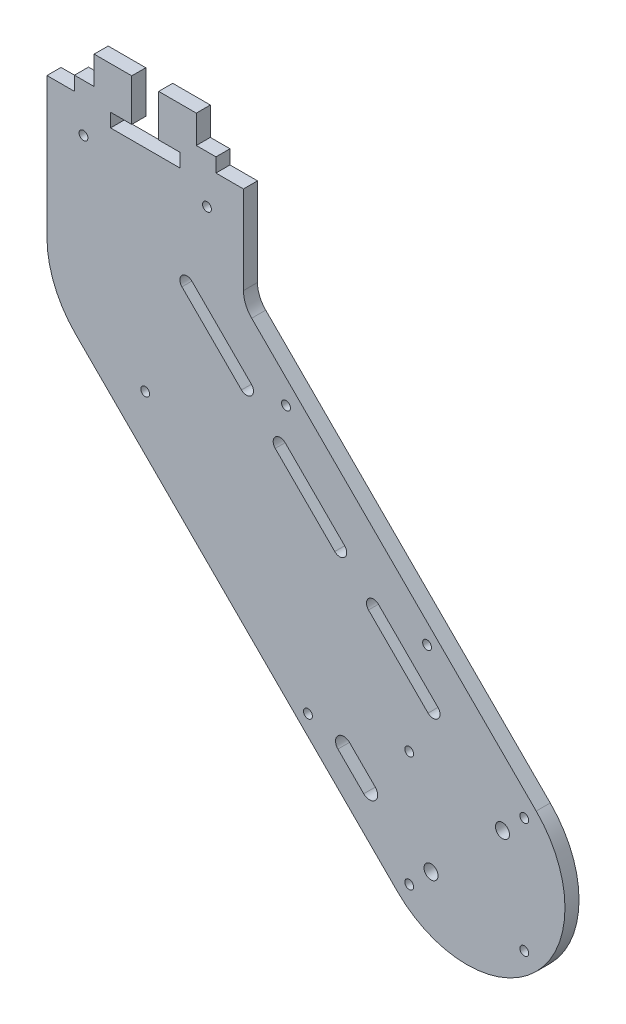
from build123d import *

# Parameters (mm, degrees)
SKETCH1_R           = 1.575
SKETCH1_R_2         = 2.5
BOSS_EXTRUDE1_DEPTH = 5
SKETCH3_W           = 13.4
SKETCH3_H           = 5
BOSS_EXTRUDE2_DEPTH = 5


with BuildPart() as part:
    # Sketch1 → Boss-Extrude1 (new body)
    with BuildSketch(Plane.XY):
        with BuildLine():
            Line((-139.300035894, 89.802561211), (-24.748737342, -24.748737342))
            ThreePointArc((-24.748737342, -24.748737342), (24.748737342, -24.748737342), (24.748737342, 24.748737342))
            Line((24.748737342, 24.748737342), (-54.672802234, 104.170276917))
            Line((-54.672802234, 104.170276917), (-76.622366364, 126.119841047))
            ThreePointArc((-76.622366364, 126.119841047), (-78.790093877, 129.364074535), (-79.551298552, 133.190908859))
            Line((-79.551298552, 133.190908859), (-79.551298552, 164.551298552))
            Line((-79.551298552, 164.551298552), (-89.351298552, 164.551298552))
            Line((-89.351298552, 164.551298552), (-89.351298552, 169.551298552))
            Line((-89.351298552, 169.551298552), (-96.351298552, 169.551298552))
            Line((-96.351298552, 169.551298552), (-96.351298552, 174.551298552))
            Line((-96.351298552, 174.551298552), (-109.751298552, 174.551298552))
            Line((-109.751298552, 174.551298552), (-109.751298552, 169.551298552))
            Line((-109.751298552, 169.551298552), (-109.751298552, 164.551298552))
            Line((-109.751298552, 164.551298552), (-102.201298552, 164.551298552))
            Line((-102.201298552, 164.551298552), (-102.201298552, 159.701298552))
            Line((-102.201298552, 159.701298552), (-126.901298552, 159.701298552))
            Line((-126.901298552, 159.701298552), (-126.901298552, 164.551298552))
            Line((-126.901298552, 164.551298552), (-119.351298552, 164.551298552))
            Line((-119.351298552, 164.551298552), (-119.351298552, 169.551298552))
            Line((-119.351298552, 169.551298552), (-119.351298552, 174.551298552))
            Line((-119.351298552, 174.551298552), (-132.751298552, 174.551298552))
            Line((-132.751298552, 174.551298552), (-132.751298552, 169.551298552))
            Line((-132.751298552, 169.551298552), (-139.751298552, 169.551298552))
            Line((-139.751298552, 169.551298552), (-139.751298552, 164.551298552))
            Line((-139.751298552, 164.551298552), (-149.551298552, 164.551298552))
            Line((-149.551298552, 164.551298552), (-149.551298552, 114.551298552))
            ThreePointArc((-149.551298552, 114.551298552), (-146.88708219, 101.157378419), (-139.300035894, 89.802561211))
        make_face()
        with Locations((-20.506096654, -20.506096654)):
            Circle(SKETCH1_R, mode=Mode.SUBTRACT)
        with Locations((-12.727922061, -12.727922061)):
            Circle(SKETCH1_R_2, mode=Mode.SUBTRACT)
        with Locations((-56.568542495, 14.142135624)):
            Circle(SKETCH1_R, mode=Mode.SUBTRACT)
        with BuildLine():
            ThreePointArc((-45.891723759, 8.555498392), (-45.891723759, 12.670859859), (-41.776362292, 12.670859859))
            Line((-41.776362292, 12.670859859), (-32.583974137, 3.478471704))
            ThreePointArc((-32.583974137, 3.478471704), (-32.583974137, -0.636889763), (-36.699335604, -0.636889763))
            Line((-36.699335604, -0.636889763), (-45.891723759, 8.555498392))
        make_face(mode=Mode.SUBTRACT)
        with Locations((20.506096654, -20.506096654)):
            Circle(SKETCH1_R, mode=Mode.SUBTRACT)
        with Locations((12.727922061, 12.727922061)):
            Circle(SKETCH1_R_2, mode=Mode.SUBTRACT)
        with Locations((-20.506096654, 20.506096654)):
            Circle(SKETCH1_R, mode=Mode.SUBTRACT)
        with BuildLine():
            ThreePointArc((-35.001785669, 56.922095886), (-35.001785669, 60.457629791), (-31.466251763, 60.457629791))
            Line((-31.466251763, 60.457629791), (-10.253048327, 39.244426356))
            ThreePointArc((-10.253048327, 39.244426356), (-10.253048327, 35.70889245), (-13.788582233, 35.70889245))
            Line((-13.788582233, 35.70889245), (-35.001785669, 56.922095886))
        make_face(mode=Mode.SUBTRACT)
        with Locations((-14.142135624, 56.568542495)):
            Circle(SKETCH1_R, mode=Mode.SUBTRACT)
        with Locations((20.506096654, 20.506096654)):
            Circle(SKETCH1_R, mode=Mode.SUBTRACT)
        with Locations((-114.551298552, 84.551298552)):
            Circle(SKETCH1_R, mode=Mode.SUBTRACT)
        with BuildLine():
            ThreePointArc((-101.4698231, 123.390133317), (-101.4698231, 126.925667223), (-97.934289194, 126.925667223))
            Line((-97.934289194, 126.925667223), (-76.721085759, 105.712463787))
            ThreePointArc((-76.721085759, 105.712463787), (-76.721085759, 102.176929881), (-80.256619665, 102.176929881))
            Line((-80.256619665, 102.176929881), (-101.4698231, 123.390133317))
        make_face(mode=Mode.SUBTRACT)
        with Locations((-64.396887007, 105.308740477)):
            Circle(SKETCH1_R, mode=Mode.SUBTRACT)
        with Locations((-136.551298552, 152.551298552)):
            Circle(SKETCH1_R, mode=Mode.SUBTRACT)
        with Locations((-92.551298552, 152.551298552)):
            Circle(SKETCH1_R, mode=Mode.SUBTRACT)
        with BuildLine():
            ThreePointArc((-68.235804384, 90.156114601), (-68.235804384, 93.691648507), (-64.700270479, 93.691648507))
            Line((-64.700270479, 93.691648507), (-43.487067043, 72.478445072))
            ThreePointArc((-43.487067043, 72.478445072), (-43.487067043, 68.942911166), (-47.022600949, 68.942911166))
            Line((-47.022600949, 68.942911166), (-68.235804384, 90.156114601))
        make_face(mode=Mode.SUBTRACT)
    extrude(amount=-BOSS_EXTRUDE1_DEPTH)

    # Sketch3 → Boss-Extrude2 (add)
    with BuildSketch(Plane.XY):
        with Locations((-126.051298552, 177.051298552)):
            Rectangle(SKETCH3_W, SKETCH3_H)
        with Locations((-103.051298552, 177.051298552)):
            Rectangle(SKETCH3_W, SKETCH3_H)
    extrude(amount=-BOSS_EXTRUDE2_DEPTH)


solid = part.part
